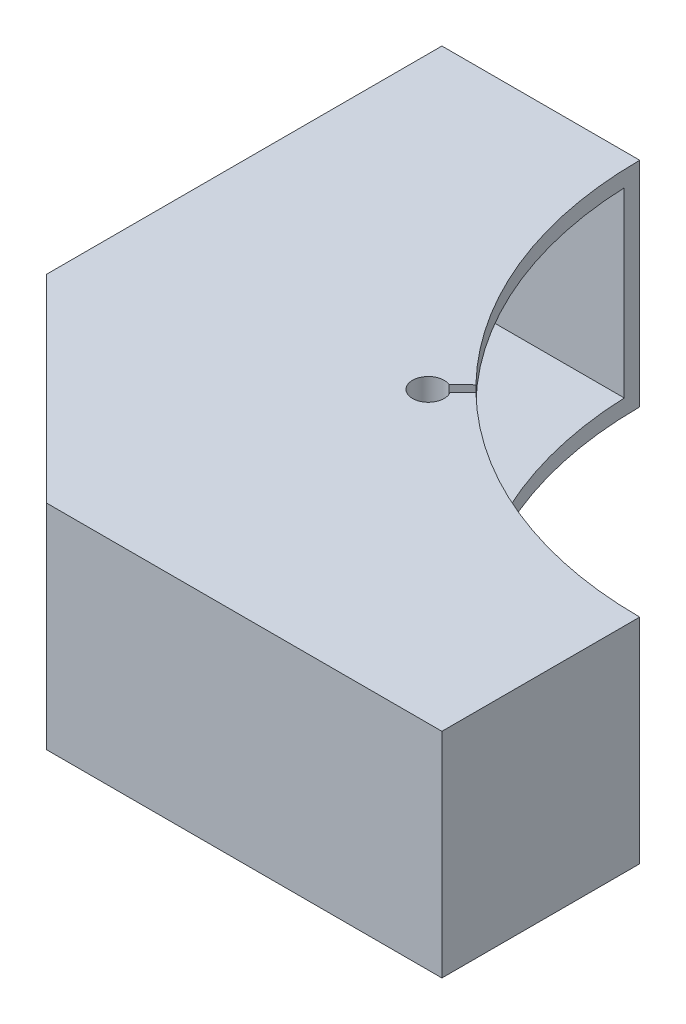
from build123d import *

# Parameters (mm, degrees)
BOSS_EXTRUDE1_DEPTH = 27
SHELL1_T            = -2
CUT_EXTRUDE1_DEPTH  = 9.525
BOSS_EXTRUDE2_DEPTH = 4
BOSS_EXTRUDE3_START = 4
BOSS_EXTRUDE3_DEPTH = 4


with BuildPart() as part:
    # Sketch3 → Boss-Extrude1 (new body)
    with BuildSketch(Plane(origin=(0, 0, 0), x_dir=(1, 0, 0), z_dir=(0, 1, 0))):
        with BuildLine():
            Line((0, 0), (-50, 0))
            Line((-50, 0), (-74.999999958, 24.999999958))
            Line((-74.999999958, 24.999999958), (-74.999999958, 74.999999958))
            Line((-74.999999958, 74.999999958), (-49.999999958, 74.999999958))
            ThreePointArc((-49.999999958, 74.999999958), (-46.307946536, 56.143327838), (-35.777036608, 40.071449353))
            Line((-35.777036608, 40.071449353), (-37.489680236, 38.399422676))
            ThreePointArc((-37.489680236, 38.399422676), (-39.581385752, 35.04480348), (-36.576633855, 37.613882683))
            Line((-36.576633855, 37.613882683), (-34.928507994, 39.222921692))
            ThreePointArc((-34.928507994, 39.222921692), (-18.856644541, 28.692042147), (0, 24.999999958))
            Line((0, 24.999999958), (0, 0))
        make_face()
    extrude(amount=BOSS_EXTRUDE1_DEPTH)

    # Shell1
    shell1_openings = [part.faces().sort_by_distance(p)[0] for p in [
        (-46.307946536, 13.5, -56.143327838),
        (-36.633358422, 13.5, -39.235436014),
        (-39.581385752, 13.5, -35.04480348),
        (-35.752570925, 13.5, -38.418402187),
        (-18.856644541, 13.5, -28.692042147),
    ]]
    offset(amount=SHELL1_T, openings=shell1_openings, kind=Kind.INTERSECTION)

    # Sketch5 → Cut-Extrude1 (cut)
    with BuildSketch(Plane(origin=(-25, 0, 25), x_dir=(0.7071067811865527, 0, 0.7071067811865425), z_dir=(-0.7071067811865425, 0, 0.7071067811865527))):
        with BuildLine():
            ThreePointArc((-63.126370107, 21.20805116), (-60.741059719, 3.406638453), (-42.939647012, 5.79194884))
            Line((-42.939647012, 5.79194884), (-63.126370107, 21.20805116))
        make_face()
        with BuildLine():
            Line((-63.126370107, 21.20805116), (-42.939647012, 5.79194884))
            ThreePointArc((-42.939647012, 5.79194884), (-41.002304265, 9.431566127), (-40.333008559, 13.5))
            ThreePointArc((-40.333008559, 13.5), (-48.964574687, 25.530704295), (-63.126370107, 21.20805116))
        make_face()
    extrude(amount=-CUT_EXTRUDE1_DEPTH, mode=Mode.SUBTRACT)

    # Sketch6 → Boss-Extrude2 (add)
    with BuildSketch(Plane(origin=(0, 2, 0), x_dir=(1, 0, 0), z_dir=(0, 1, 0))):
        with BuildLine():
            Line((-34.777058513, 39.075687839), (-34.928507994, 39.222921692))
            Line((-34.928507994, 39.222921692), (-36.576633855, 37.613882683))
            ThreePointArc((-36.576633855, 37.613882683), (-39.581385752, 35.04480348), (-37.489680236, 38.399422676))
            Line((-37.489680236, 38.399422676), (-35.777036608, 40.071449353))
            ThreePointArc((-35.777036608, 40.071449353), (-41.317990025, 33.507045583), (-34.777058513, 39.075687839))
        make_face()
    extrude(amount=BOSS_EXTRUDE2_DEPTH)

    # Sketch7 → Boss-Extrude3 (add)
    with BuildSketch(Plane.XZ.offset(-25).offset(BOSS_EXTRUDE3_START)):
        with BuildLine():
            ThreePointArc((-37.489680236, -38.399422676), (-39.581385752, -35.04480348), (-36.576633855, -37.613882683))
            Line((-36.576633855, -37.613882683), (-34.928507994, -39.222921692))
            ThreePointArc((-34.928507994, -39.222921692), (-41.218708816, -33.455259804), (-35.800323385, -40.048714843))
            Line((-35.800323385, -40.048714843), (-37.489680236, -38.399422676))
        make_face()
    extrude(amount=-BOSS_EXTRUDE3_DEPTH)


solid = part.part
